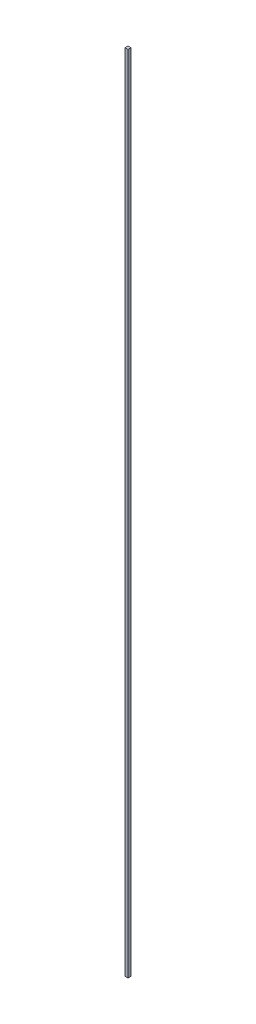
from build123d import *

# Parameters (mm, degrees)
SKETCH1_W           = 2
SKETCH1_H           = 2
BOSS_EXTRUDE1_DEPTH = 541.9


with BuildPart() as part:
    # Sketch1 → Boss-Extrude1 (new body)
    with BuildSketch(Plane(origin=(0, 0, 0), x_dir=(1, 0, 0), z_dir=(0, 1, 0))):
        with Locations((1, 1)):
            Rectangle(SKETCH1_W, SKETCH1_H)
    extrude(amount=BOSS_EXTRUDE1_DEPTH)


solid = part.part
